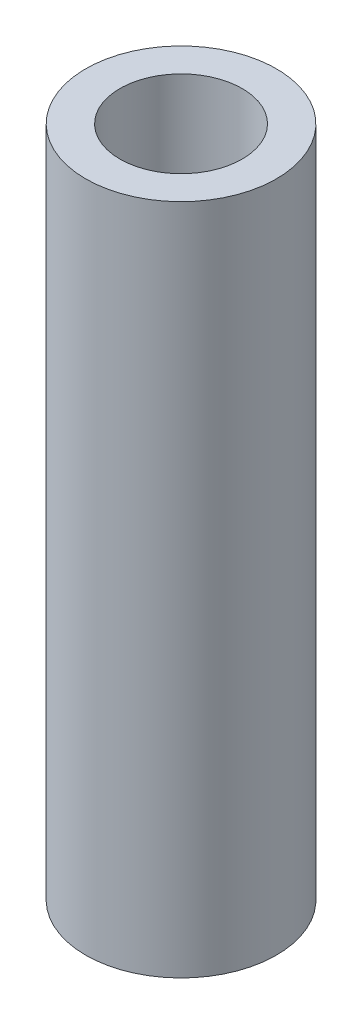
from build123d import *

# Parameters (mm, degrees)
SKETCH1_R           = 27.875
SKETCH1_R_2         = 17.875
BOSS_EXTRUDE1_DEPTH = 196.5
SKETCH2_R           = 11.53
CUT_EXTRUDE1_DEPTH  = 201.415271998


with BuildPart() as part:
    # Sketch1 → Boss-Extrude1 (new body)
    with BuildSketch(Plane(origin=(0, 0, 0), x_dir=(1, 0, 0), z_dir=(0, 1, 0))):
        with Locations(Location((0, 0, 0), (0, 0, 270))):
            Circle(SKETCH1_R)
        with Locations(Location((0, 0, 0), (0, 0, 270))):
            Circle(SKETCH1_R_2, mode=Mode.SUBTRACT)
    extrude(amount=BOSS_EXTRUDE1_DEPTH)

    # Sketch2 → Cut-Extrude1 (cut, through all)
    with BuildSketch(Plane(origin=(0, 0, 0), x_dir=(0, 0, -1), z_dir=(1, 0, 0))):
        with Locations((0, 131.8)):
            Circle(SKETCH2_R)
        with Locations((0, 80.8)):
            Circle(SKETCH2_R)
        with Locations((0, 29.8)):
            Circle(SKETCH2_R)
    extrude(amount=-CUT_EXTRUDE1_DEPTH, mode=Mode.SUBTRACT)


solid = part.part
